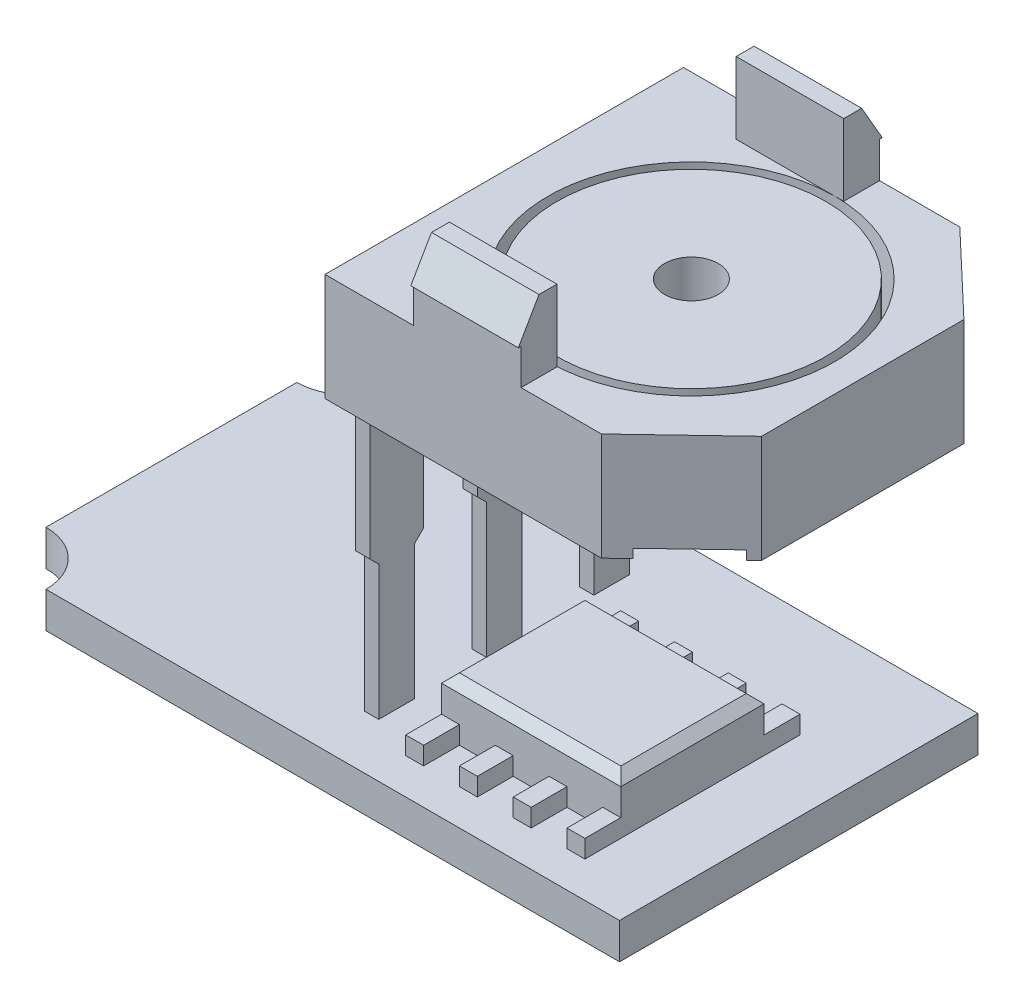
from build123d import *

# Parameters (mm, degrees)
BOSS_EXTRUDE1_DEPTH      = 1
SKETCH2_W                = 5
SKETCH2_H                = 4
BOSS_EXTRUDE2_DEPTH      = 1.5
CHAMFER1_SIZE            = 0.25
SKETCH4_W                = 0.5
SKETCH4_H                = 1
BOSS_EXTRUDE3_DEPTH      = 0.5
BOSS_EXTRUDE4_DEPTH      = 0.4
CHAMFER1_OF_MIRROR1_SIZE = 0.25
SKETCH6_R                = 4
BOSS_EXTRUDE5_DEPTH      = 1.5
SKETCH7_W                = 3
SKETCH7_H                = 1
BOSS_EXTRUDE6_DEPTH      = 2
BOSS_EXTRUDE7_DEPTH      = 3
CUT_EXTRUDE1_DEPTH       = 3
SKETCH10_R               = 2.5
BOSS_EXTRUDE8_DEPTH      = 0.25
CUT_EXTRUDE2_DEPTH       = 0.25
SKETCH13_R               = 2.5
BOSS_EXTRUDE11_DEPTH     = 0.25
BOSS_EXTRUDE12_START     = -0.25
SKETCH14_R               = 2.5
BOSS_EXTRUDE12_DEPTH     = 0.25
SKETCH15_R               = 3.75
BOSS_EXTRUDE13_DEPTH     = 2.5
SKETCH17_R               = 0.75
CUT_EXTRUDE3_DEPTH       = 3
CUT_EXTRUDE5_DEPTH       = 7


with BuildPart() as part:
    # Sketch1 → Boss-Extrude1 (new body)
    with BuildSketch(Plane(origin=(0, 0, 0), x_dir=(1, 0, 0), z_dir=(0, 1, 0))):
        with BuildLine():
            Line((8.75, -5), (-7.25, -5))
            ThreePointArc((-7.25, -5), (-7.689339828, -3.939339828), (-8.75, -3.5))
            Line((-8.75, -3.5), (-8.75, 3.5))
            ThreePointArc((-8.75, 3.5), (-7.689339828, 3.939339828), (-7.25, 5))
            Line((-7.25, 5), (8.75, 5))
            Line((8.75, 5), (8.75, -5))
        make_face()
    extrude(amount=BOSS_EXTRUDE1_DEPTH)

    # Sketch2 → Boss-Extrude2 (add)
    with BuildSketch(Plane(origin=(0, 1, 0), x_dir=(1, 0, 0), z_dir=(0, 1, 0))):
        with Locations((4.283897802, -1)):
            Rectangle(SKETCH2_W, SKETCH2_H)
    boss_extrude2 = extrude(amount=BOSS_EXTRUDE2_DEPTH)

    # Chamfer1
    chamfer1_edges = [part.edges().sort_by_distance(p)[0] for p in [
        (6.783897802, 2.5, 1),
        (4.283897802, 2.5, -1),
        (1.783897802, 2.5, 1),
        (4.283897802, 2.5, 3),
    ]]
    chamfer(chamfer1_edges, length=CHAMFER1_SIZE)

    # Sketch4 → Boss-Extrude3 (add)
    with BuildSketch(Plane(origin=(0, 1, 0), x_dir=(1, 0, 0), z_dir=(0, 1, 0))):
        with Locations((5.033897802, -3.5)):
            Rectangle(SKETCH4_W, SKETCH4_H)
        with Locations((6.533897802, -3.5)):
            Rectangle(SKETCH4_W, SKETCH4_H)
        with Locations((3.533897802, -3.5)):
            Rectangle(SKETCH4_W, SKETCH4_H)
        with Locations((2.033897802, -3.5)):
            Rectangle(SKETCH4_W, SKETCH4_H)
        with Locations((6.533897802, 1.5)):
            Rectangle(SKETCH4_W, SKETCH4_H)
        with Locations((5.033897802, 1.5)):
            Rectangle(SKETCH4_W, SKETCH4_H)
        with Locations((3.533897802, 1.5)):
            Rectangle(SKETCH4_W, SKETCH4_H)
        with Locations((2.033897802, 1.5)):
            Rectangle(SKETCH4_W, SKETCH4_H)
    boss_extrude3 = extrude(amount=BOSS_EXTRUDE3_DEPTH)

    # Sketch5 → Boss-Extrude4 (add)
    with BuildSketch(Plane.ZY.offset(-0.533897802)):
        Polygon((3.5, -0.622790988), (2.5, -0.622790988), (2.5, 4.75), (2.25, 5), (2.25, 11), (3.75, 11), (3.75, 5), (3.5, 4.75), align=None)
        Polygon((0.5, -0.622790988), (-0.5, -0.622790988), (-0.5, 4.75), (-0.75, 5), (-0.75, 11), (0.75, 11), (0.75, 5), (0.5, 4.75), align=None)
        Polygon((-2.5, -0.622790988), (-3.5, -0.622790988), (-3.5, 4.75), (-3.75, 5), (-3.75, 11), (-2.25, 11), (-2.25, 5), (-2.5, 4.75), align=None)
    extrude(amount=BOSS_EXTRUDE4_DEPTH)

    # Mirror1: Boss-Extrude2, Boss-Extrude3 across plane
    add(boss_extrude2.mirror(Plane.ZX.offset(0.5)))
    add(boss_extrude3.mirror(Plane.ZX.offset(0.5)))

    # Chamfer1 of Mirror1
    chamfer1_of_mirror1_edges = [part.edges().sort_by_distance(p)[0] for p in [
        (6.783897802, -1.5, 1),
        (4.283897802, -1.5, -1),
        (1.783897802, -1.5, 1),
        (4.283897802, -1.5, 3),
    ]]
    chamfer(chamfer1_of_mirror1_edges, length=CHAMFER1_OF_MIRROR1_SIZE)

    # Sketch6 → Boss-Extrude5 (add, symmetric)
    with BuildSketch(Plane(origin=(0, 11, 0), x_dir=(1, 0, 0), z_dir=(0, 1, 0))):
        with BuildLine():
            Line((0.533897802, 5), (8.533897802, 5))
            ThreePointArc((8.533897802, 5), (9.948111365, 4.414213562), (10.533897802, 3))
            Line((10.533897802, 3), (10.533897802, -3))
            ThreePointArc((10.533897802, -3), (9.948111365, -4.414213562), (8.533897802, -5))
            Line((8.533897802, -5), (0.533897802, -5))
            Line((0.533897802, -5), (0.533897802, 5))
        make_face()
        with Locations(Location((5.753897802, 0, 0), (0, 0, 270))):
            Circle(SKETCH6_R, mode=Mode.SUBTRACT)
    extrude(amount=BOSS_EXTRUDE5_DEPTH, both=True)

    # Sketch7 → Boss-Extrude6 (add)
    with BuildSketch(Plane(origin=(0, 12.5, 0), x_dir=(1, 0, 0), z_dir=(0, 1, 0))):
        with Locations((4.503897802, 4.5)):
            Rectangle(SKETCH7_W, SKETCH7_H)
    boss_extrude6 = extrude(amount=BOSS_EXTRUDE6_DEPTH)

    # Sketch8 → Boss-Extrude7 (add)
    with BuildSketch(Plane(origin=(6.003897802, 0, 0), x_dir=(0, 0, -1), z_dir=(1, 0, 0))):
        Polygon((4.5, 14.5), (5.077350269, 13.5), (4.5, 13.5), align=None)
    boss_extrude7 = extrude(amount=-BOSS_EXTRUDE7_DEPTH)

    # Sketch9 → Cut-Extrude1 (cut)
    with BuildSketch(Plane(origin=(6.003897802, 0, 0), x_dir=(0, 0, -1), z_dir=(1, 0, 0))):
        Polygon((4.5, 14.5), (5, 13.633974596), (5, 14.5), align=None)
    cut_extrude1 = extrude(amount=-CUT_EXTRUDE1_DEPTH, mode=Mode.SUBTRACT)

    # Mirror2: Boss-Extrude6, Boss-Extrude7, Cut-Extrude1 across plane
    add(boss_extrude6.mirror(Plane.XY))
    add(boss_extrude7.mirror(Plane.XY))
    add(cut_extrude1.mirror(Plane.XY), mode=Mode.SUBTRACT)

    # Sketch10 → Boss-Extrude8 (add)
    with BuildSketch(Plane.XZ.offset(-9.5)):
        with BuildLine():
            ThreePointArc((5.003897802, -3.929058411), (5.753897802, -4), (6.503897802, -3.929058411))
            Line((6.503897802, -3.929058411), (6.503897802, -3.418698583))
            ThreePointArc((6.503897802, -3.418698583), (8.228771537, -2.474873734), (9.172596385, -0.75))
            Line((9.172596385, -0.75), (9.682956214, -0.75))
            ThreePointArc((9.682956214, -0.75), (9.736122912, -0.376673834), (9.753897802, 0))
            ThreePointArc((9.753897802, 0), (9.736122912, 0.376673834), (9.682956214, 0.75))
            Line((9.682956214, 0.75), (9.172596385, 0.75))
            ThreePointArc((9.172596385, 0.75), (8.228771537, 2.474873734), (6.503897802, 3.418698583))
            Line((6.503897802, 3.418698583), (6.503897802, 3.929058411))
            ThreePointArc((6.503897802, 3.929058411), (5.753897802, 4), (5.003897802, 3.929058411))
            Line((5.003897802, 3.929058411), (5.003897802, 3.418698583))
            ThreePointArc((5.003897802, 3.418698583), (3.279024068, 2.474873734), (2.33519922, 0.75))
            Line((2.33519922, 0.75), (1.824839391, 0.75))
            ThreePointArc((1.824839391, 0.75), (1.753897802, 0), (1.824839391, -0.75))
            Line((1.824839391, -0.75), (2.33519922, -0.75))
            ThreePointArc((2.33519922, -0.75), (3.279024068, -2.474873734), (5.003897802, -3.418698583))
            Line((5.003897802, -3.418698583), (5.003897802, -3.929058411))
        make_face()
        with Locations(Location((5.753897802, 0, 0), (0, 0, 270))):
            Circle(SKETCH10_R, mode=Mode.SUBTRACT)
    extrude(amount=-BOSS_EXTRUDE8_DEPTH)

    # Sketch11 → Cut-Extrude2 (cut)
    with BuildSketch(Plane.XZ.offset(-9.5)):
        with BuildLine():
            Line((9.682956214, 0.75), (10.322596385, 0.75))
            Line((10.322596385, 0.75), (10.322596385, 3.068698583))
            ThreePointArc((10.322596385, 3.068698583), (9.883256557, 4.129358755), (8.822596385, 4.568698583))
            Line((8.822596385, 4.568698583), (6.503897802, 4.568698583))
            Line((6.503897802, 4.568698583), (6.503897802, 3.929058411))
            ThreePointArc((6.503897802, 3.929058411), (8.582324927, 2.828427125), (9.682956214, 0.75))
        make_face()
        with BuildLine():
            Line((10.322596385, -3.068698583), (10.322596385, -0.75))
            Line((10.322596385, -0.75), (9.682956214, -0.75))
            ThreePointArc((9.682956214, -0.75), (8.582324927, -2.828427125), (6.503897802, -3.929058411))
            Line((6.503897802, -3.929058411), (6.503897802, -4.568698583))
            Line((6.503897802, -4.568698583), (8.822596385, -4.568698583))
            ThreePointArc((8.822596385, -4.568698583), (9.883256557, -4.129358755), (10.322596385, -3.068698583))
        make_face()
        with BuildLine():
            Line((2.68519922, -4.568698583), (5.003897802, -4.568698583))
            Line((5.003897802, -4.568698583), (5.003897802, -3.929058411))
            ThreePointArc((5.003897802, -3.929058411), (2.925470678, -2.828427125), (1.824839391, -0.75))
            Line((1.824839391, -0.75), (1.18519922, -0.75))
            Line((1.18519922, -0.75), (1.18519922, -3.068698583))
            ThreePointArc((1.18519922, -3.068698583), (1.624539048, -4.129358755), (2.68519922, -4.568698583))
        make_face()
        with BuildLine():
            Line((1.18519922, 3.068698583), (1.18519922, 0.75))
            Line((1.18519922, 0.75), (1.824839391, 0.75))
            ThreePointArc((1.824839391, 0.75), (2.925470678, 2.828427125), (5.003897802, 3.929058411))
            Line((5.003897802, 3.929058411), (5.003897802, 4.568698583))
            Line((5.003897802, 4.568698583), (2.68519922, 4.568698583))
            ThreePointArc((2.68519922, 4.568698583), (1.624539048, 4.129358755), (1.18519922, 3.068698583))
        make_face()
    extrude(amount=-CUT_EXTRUDE2_DEPTH, mode=Mode.SUBTRACT)

    # Sketch13 → Boss-Extrude11 (add)
    with BuildSketch(Plane(origin=(0, 9.75, 0), x_dir=(1, 0, 0), z_dir=(0, 1, 0))):
        with BuildLine():
            ThreePointArc((5.753897802, -4), (9.753897802, 0), (5.753897802, 4))
            ThreePointArc((5.753897802, 4), (1.753897802, 0), (5.753897802, -4))
        make_face()
        with Locations(Location((5.753897802, 0, 0), (0, 0, 90))):
            Circle(SKETCH13_R, mode=Mode.SUBTRACT)
    extrude(amount=BOSS_EXTRUDE11_DEPTH)

    # Sketch14 → Boss-Extrude12 (add)
    with BuildSketch(Plane(origin=(0, 10, 0), x_dir=(1, 0, 0), z_dir=(0, 1, 0)).offset(BOSS_EXTRUDE12_START)):
        with Locations(Location((5.753897802, 0, 0), (0, 0, 90))):
            Circle(SKETCH14_R)
    extrude(amount=BOSS_EXTRUDE12_DEPTH)

    # Sketch15 → Boss-Extrude13 (add)
    with BuildSketch(Plane(origin=(0, 10, 0), x_dir=(1, 0, 0), z_dir=(0, 1, 0))):
        with Locations(Location((5.753897802, 0, 0), (0, 0, 90))):
            Circle(SKETCH15_R)
    extrude(amount=BOSS_EXTRUDE13_DEPTH)

    # Sketch17 → Cut-Extrude3 (cut)
    with BuildSketch(Plane(origin=(0, 12.5, 0), x_dir=(1, 0, 0), z_dir=(0, 1, 0))):
        with Locations(Location((5.753897802, 0, 0), (0, 0, 270))):
            Circle(SKETCH17_R)
    extrude(amount=-CUT_EXTRUDE3_DEPTH, mode=Mode.SUBTRACT)

    # Sketch19 → Cut-Extrude5 (cut)
    with BuildSketch(Plane(origin=(0, 12.5, 0), x_dir=(1, 0, 0), z_dir=(0, 1, 0))):
        with BuildLine():
            Line((10.533897802, -3), (10.533897802, -2.823055401))
            Line((10.533897802, -2.823055401), (8.242765452, -5))
            Line((8.242765452, -5), (8.533897802, -5))
            ThreePointArc((8.533897802, -5), (9.948111365, -4.414213562), (10.533897802, -3))
        make_face()
        with BuildLine():
            Line((8.533897802, 5), (8.242765452, 5))
            Line((8.242765452, 5), (10.533897802, 2.823055401))
            Line((10.533897802, 2.823055401), (10.533897802, 3))
            ThreePointArc((10.533897802, 3), (9.948111365, 4.414213562), (8.533897802, 5))
        make_face()
    extrude(amount=-CUT_EXTRUDE5_DEPTH, mode=Mode.SUBTRACT)


solid = part.part
